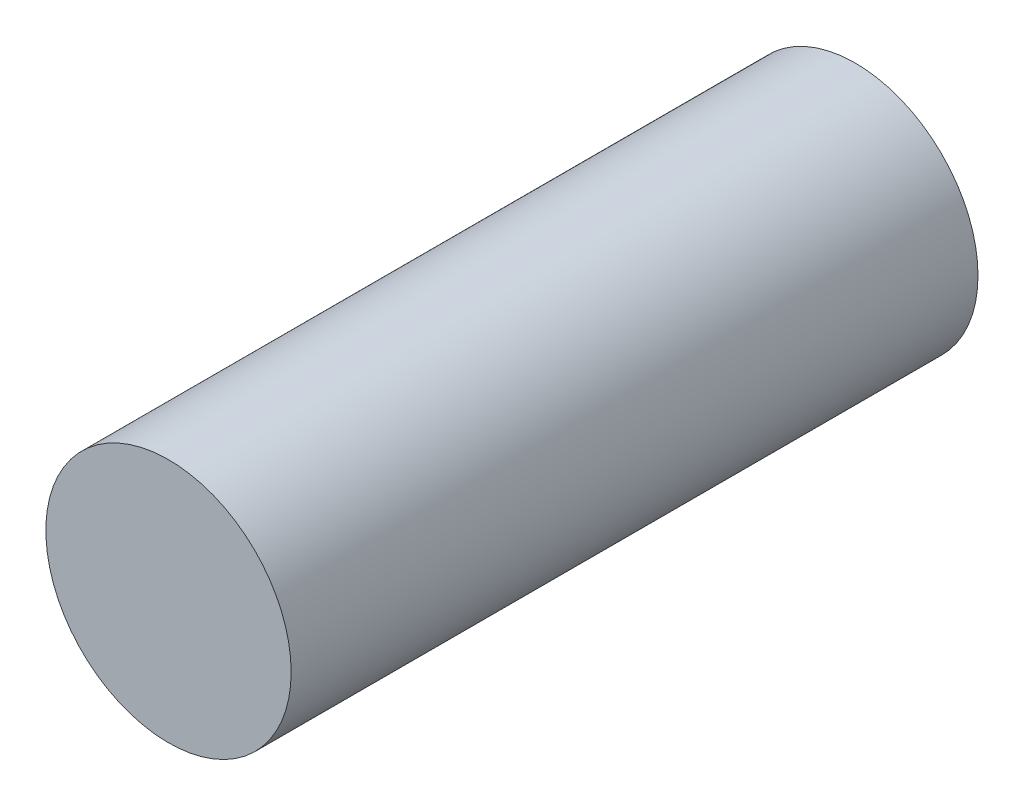
from build123d import *

# Parameters (mm, degrees)
SKETCH_1_R      = 2.5
EXTRUDE_1_DEPTH = 14


with BuildPart() as part:
    # Эскиз1 → Бобышка-Вытянуть1 (new body)
    with BuildSketch(Plane.XY):
        Circle(SKETCH_1_R)
    extrude(amount=EXTRUDE_1_DEPTH)


solid = part.part
